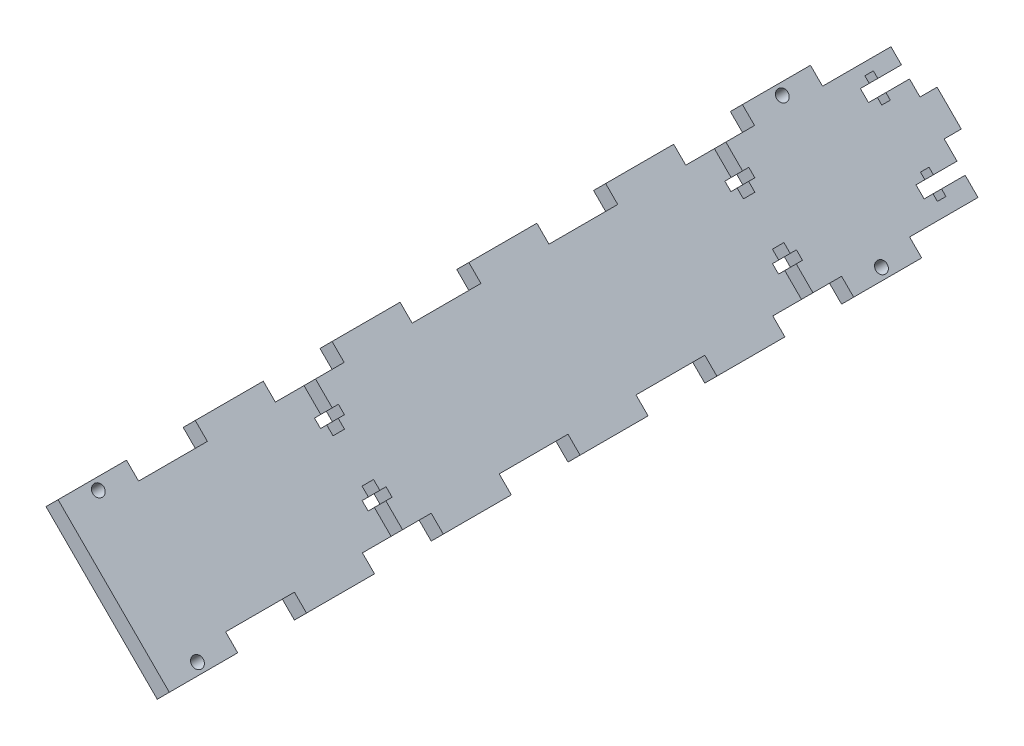
from build123d import *

# Parameters (mm, degrees)
BOSS_EXTRUDE1_DEPTH = 304.8
SKETCH2_W           = 25.542619615
SKETCH2_H           = 6.35
CUT_EXTRUDE1_DEPTH  = 6.35
LPATTERN1_COUNT     = 6
LPATTERN1_PITCH     = 50.8
BOSS_EXTRUDE2_DEPTH = 6.35
CUT_EXTRUDE2_DEPTH  = 315.265122799
SKETCH5_R           = 2.0955
CUT_EXTRUDE3_DEPTH  = 315.265122799
CUT_EXTRUDE4_DEPTH  = 315.265122799


with BuildPart() as part:
    # Sketch1 → Boss-Extrude1 (new body)
    with BuildSketch(Plane.XY):
        Polygon((69.147972132, 48.095032857), (110.457150289, 6.7858547), (114.94727835, 11.275982761), (73.638100193, 52.585160918), align=None)
    extrude(amount=BOSS_EXTRUDE1_DEPTH)

    # Sketch2 → Cut-Extrude1 (cut)
    with BuildSketch(Plane(origin=(63.111630555, 63.111630555, 0), x_dir=(0, 0, -1), z_dir=(0.7071067811865472, 0.7071067811865478, 0))):
        with Locations((-266.628690193, -18.061676125)):
            Rectangle(SKETCH2_W, SKETCH2_H)
        with Locations((-266.628690193, -70.131676125)):
            Rectangle(SKETCH2_W, SKETCH2_H)
    cut_extrude1 = extrude(amount=-CUT_EXTRUDE1_DEPTH, mode=Mode.SUBTRACT)

    # LPattern1: Cut-Extrude1 ×6
    with Locations(*[(0, 0, -i * LPATTERN1_PITCH) for i in range(1, LPATTERN1_COUNT)]):
        add(cut_extrude1, mode=Mode.SUBTRACT)

    # Sketch3 → Boss-Extrude2 (add)
    with BuildSketch(Plane(origin=(0, 0, 0), x_dir=(-1, 0, 0), z_dir=(0, 0, -1))):
        Polygon((-84.426151589, 32.816853401), (-93.40640771, 23.83659728), (-97.89653577, 28.32672534), (-88.916279649, 37.306981461), align=None)
    extrude(amount=BOSS_EXTRUDE2_DEPTH)

    # Sketch4 → Cut-Extrude2 (cut, through all)
    with BuildSketch(Plane(origin=(58.621502495, 58.621502495, 0), x_dir=(-0.7071067811865478, 0.7071067811865472, 0), z_dir=(-0.7071067811865472, -0.7071067811865478, 0))):
        Polygon((-55.941380423, 0), (-60.208580423, 0), (-60.208580423, -8.763), (-62.519980423, -8.763), (-62.519980423, -11.938), (-60.208580423, -11.938), (-60.208580423, -15.24), (-55.941380423, -15.24), (-55.941380423, -11.938), (-53.629980423, -11.938), (-53.629980423, -8.763), (-55.941380423, -8.763), align=None)
        Polygon((-26.731380423, 0), (-30.998580423, 0), (-30.998580423, -8.763), (-33.309980423, -8.763), (-33.309980423, -11.938), (-30.998580423, -11.938), (-30.998580423, -15.24), (-26.731380423, -15.24), (-26.731380423, -11.938), (-24.419980423, -11.938), (-24.419980423, -8.763), (-26.731380423, -8.763), align=None)
    extrude(amount=-CUT_EXTRUDE2_DEPTH, mode=Mode.SUBTRACT)

    # Sketch5 → Cut-Extrude3 (cut, through all)
    with BuildSketch(Plane(origin=(58.621502495, 58.621502495, 0), x_dir=(-0.7071067811865478, 0.7071067811865472, 0), z_dir=(-0.7071067811865472, -0.7071067811865478, 0))):
        with Locations(Location((-18.061676125, -38.1, 0), (0, 0, 180))):
            Circle(SKETCH5_R)
        with Locations(Location((-18.061676125, -292.1, 0), (0, 0, 180))):
            Circle(SKETCH5_R)
    cut_extrude3 = extrude(amount=-CUT_EXTRUDE3_DEPTH, mode=Mode.SUBTRACT)

    # Mirror1: Cut-Extrude3 across plane
    add(cut_extrude3.mirror(Plane(origin=(31.181058716, -31.181058716, 0), x_dir=(0, 0, 1), z_dir=(0.7071067811865478, -0.7071067811865472, 0))), mode=Mode.SUBTRACT)

    # Sketch6 → Cut-Extrude4 (cut, through all)
    with BuildSketch(Plane(origin=(58.621502495, 58.621502495, 0), x_dir=(-0.7071067811865478, 0.7071067811865472, 0), z_dir=(-0.7071067811865472, -0.7071067811865478, 0))):
        Polygon((-21.236676125, -65.562290193), (-21.236676125, -61.295090193), (-29.999676125, -61.295090193), (-29.999676125, -58.983690193), (-33.174676125, -58.983690193), (-33.174676125, -61.295090193), (-36.476676125, -61.295090193), (-36.476676125, -65.562290193), (-33.174676125, -65.562290193), (-33.174676125, -67.873690193), (-29.999676125, -67.873690193), (-29.999676125, -65.562290193), align=None)
        Polygon((-21.236676125, -217.962290193), (-21.236676125, -213.695090193), (-29.999676125, -213.695090193), (-29.999676125, -211.383690193), (-33.174676125, -211.383690193), (-33.174676125, -213.695090193), (-36.476676125, -213.695090193), (-36.476676125, -217.962290193), (-33.174676125, -217.962290193), (-33.174676125, -220.273690193), (-29.999676125, -220.273690193), (-29.999676125, -217.962290193), align=None)
    cut_extrude4 = extrude(amount=-CUT_EXTRUDE4_DEPTH, mode=Mode.SUBTRACT)

    # Mirror2: Cut-Extrude4 across plane
    add(cut_extrude4.mirror(Plane(origin=(31.181058716, -31.181058716, 0), x_dir=(0, 0, 1), z_dir=(0.7071067811865478, -0.7071067811865472, 0))), mode=Mode.SUBTRACT)


solid = part.part
